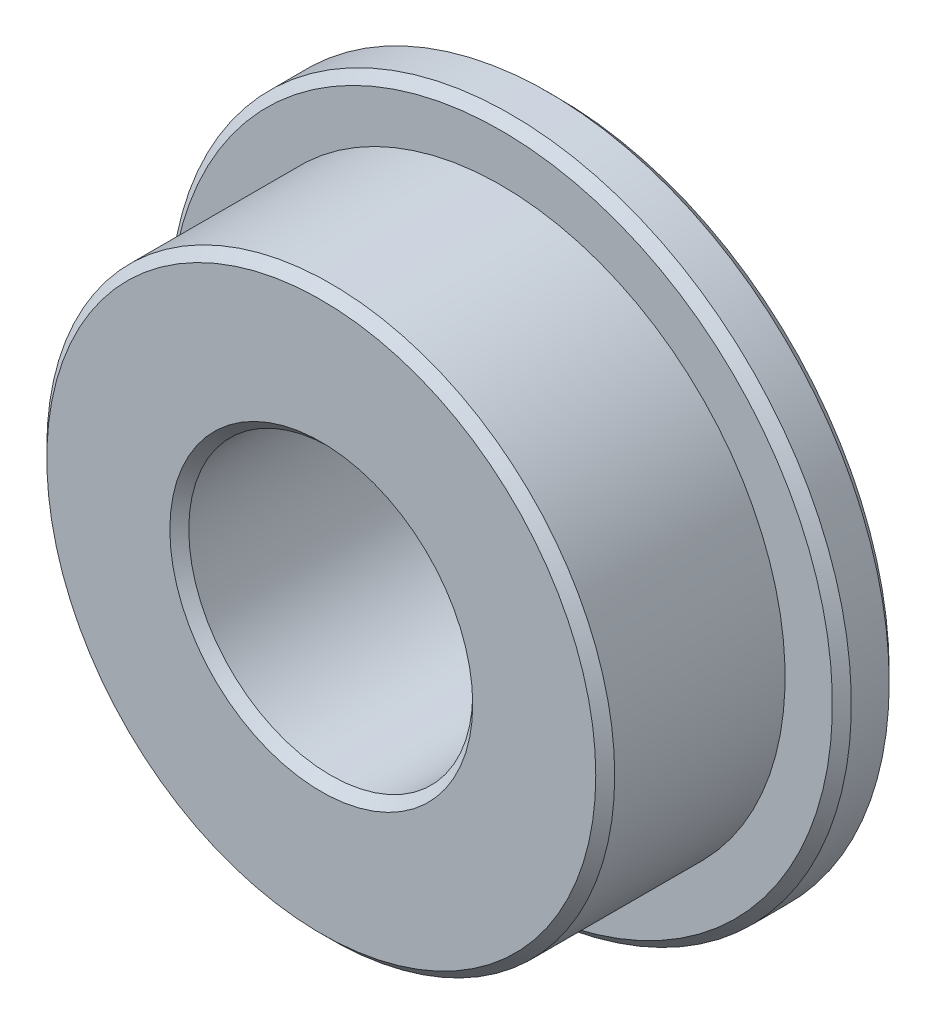
from build123d import *

# Parameters (mm, degrees)
SKETCH_1_R      = 3
SKETCH_1_R_2    = 1.5
EXTRUDE_1_DEPTH = 1.25
EXTRUDE_START   = -0.6
SKETCH_2_R      = 3.6
SKETCH_2_R_2    = 3
EXTRUDE_2_DEPTH = 0.6
CHAMFER_1_SIZE  = 0.1


with BuildPart() as part:
    # 草图1 → 凸台-拉伸1 (new, symmetric)
    with BuildSketch(Plane.XY):
        Circle(SKETCH_1_R)
        Circle(SKETCH_1_R_2, mode=Mode.SUBTRACT)
    extrude(amount=EXTRUDE_1_DEPTH, both=True)

    # 草图2 → 凸台-拉伸2 (add)
    with BuildSketch(Plane(origin=(0, 0, -1.25), x_dir=(-1, 0, 0), z_dir=(0, 0, -1)).offset(EXTRUDE_START)):
        Circle(SKETCH_2_R)
        Circle(SKETCH_2_R_2, mode=Mode.SUBTRACT)
    extrude(amount=EXTRUDE_2_DEPTH)

    # 倒角1
    chamfer_1_edges = [part.edges().sort_by_distance(p)[0] for p in [
        (3.6, 0, -0.65),
        (3.6, 0, -1.25),
        (-3, 0, 1.25),
        (-1.5, 0, -1.25),
        (-1.5, 0, 1.25),
    ]]
    chamfer(chamfer_1_edges, length=CHAMFER_1_SIZE)


solid = part.part
